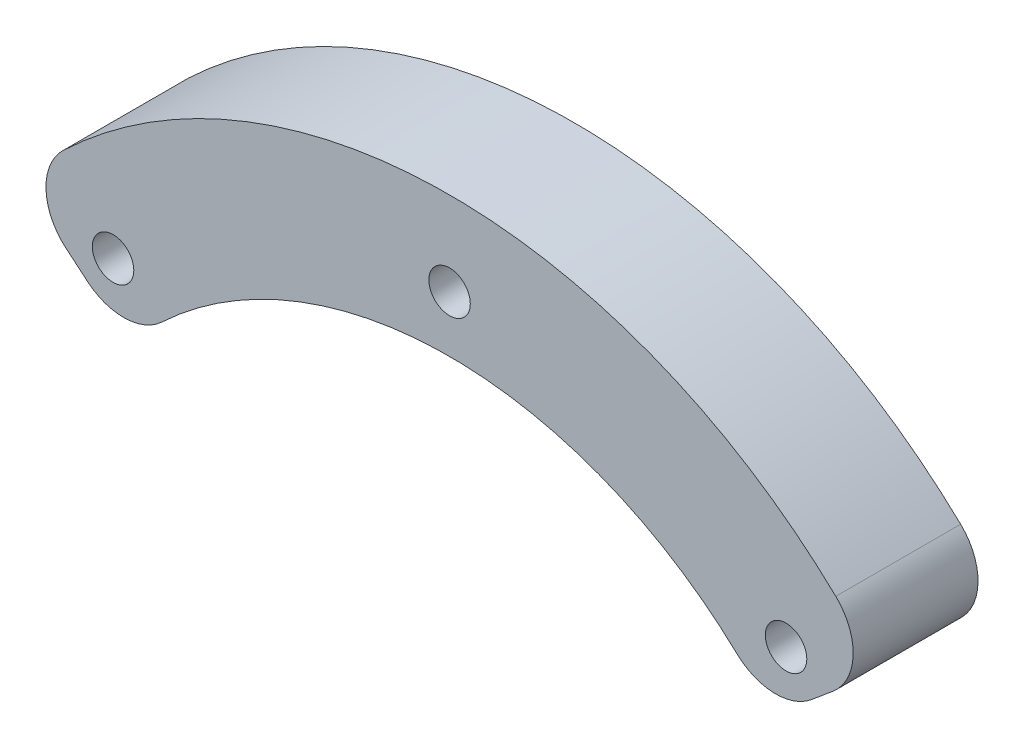
from build123d import *

# Parameters (mm, degrees)
SKETCH_1_R      = 1.85
EXTRUDE_1_DEPTH = 11.15
FILLET_3_R      = 5


with BuildPart() as part:
    # 草图1 → 凸台-拉伸1 (new body)
    # profile 1 of 2: a face of its own
    with BuildSketch(Plane.XY):
        with BuildLine():
            Line((-38.302222156, 32.139380484), (-28.726666617, 24.104535363))
            ThreePointArc((-28.726666617, 24.104535363), (-15.848184815, 33.986542014), (0, 37.5))
            Line((0, 37.5), (0, 40.65))
            ThreePointArc((0, 40.65), (-1.85, 42.5), (0, 44.35))
            Line((0, 44.35), (0, 50))
            ThreePointArc((0, 50), (-21.130913087, 45.315389352), (-38.302222156, 32.139380484))
        make_face()
        with Locations((-30.0520382, 30.0520382)):
            Circle(SKETCH_1_R, mode=Mode.SUBTRACT)
    # profile 2 of 2: a face of its own
    with BuildSketch(Plane.XY):
        with BuildLine():
            ThreePointArc((0, 37.5), (15.848184815, 33.986542014), (28.726666617, 24.104535363))
            Line((28.726666617, 24.104535363), (38.302222156, 32.139380484))
            ThreePointArc((38.302222156, 32.139380484), (21.130913087, 45.315389352), (0, 50))
            Line((0, 50), (0, 44.35))
            ThreePointArc((0, 44.35), (1.308147545, 43.808147545), (1.85, 42.5))
            ThreePointArc((1.85, 42.5), (1.308147545, 41.191852455), (0, 40.65))
            Line((0, 40.65), (0, 37.5))
        make_face()
        with Locations((30.0520382, 30.0520382)):
            Circle(SKETCH_1_R, mode=Mode.SUBTRACT)
    extrude(amount=EXTRUDE_1_DEPTH)

    # 圆角3
    fillet_3_edges = [part.edges().sort_by_distance(p)[0] for p in [
        (28.726666617, 24.104535363, 5.575),
        (-28.726666617, 24.104535363, 5.575),
        (-38.302222156, 32.139380484, 5.575),
        (38.302222156, 32.139380484, 5.575),
    ]]
    fillet(fillet_3_edges, radius=FILLET_3_R)


solid = part.part
